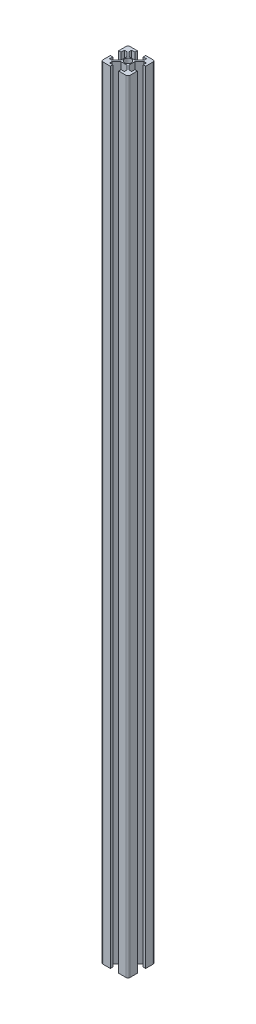
from build123d import *

# Parameters (mm, degrees)
SKETCH_1_R      = 2.5
EXTRUDE_1_DEPTH = 580


with BuildPart() as part:
    # 草图1 → 凸台-拉伸1 (new body)
    with BuildSketch(Plane(origin=(0, 0, 0), x_dir=(1, 0, 0), z_dir=(0, 1, 0))):
        with BuildLine():
            Line((-27.504847279, -8.742955359), (-29.304847279, -8.742955359))
            Line((-29.304847279, -8.742955359), (-29.304847279, -14.142955359))
            ThreePointArc((-29.304847279, -14.142955359), (-28.865507451, -15.20361553), (-27.804847279, -15.642955359))
            Line((-27.804847279, -15.642955359), (-22.404847279, -15.642955359))
            Line((-22.404847279, -15.642955359), (-22.404847279, -13.842955359))
            Line((-22.404847279, -13.842955359), (-24.804847279, -13.842955359))
            Line((-24.804847279, -13.842955359), (-24.804847279, -12.040005514))
            Line((-24.804847279, -12.040005514), (-21.507797124, -8.742955359))
            Line((-21.507797124, -8.742955359), (-17.101897434, -8.742955359))
            Line((-17.101897434, -8.742955359), (-13.804847279, -12.040005514))
            Line((-13.804847279, -12.040005514), (-13.804847279, -13.842955359))
            Line((-13.804847279, -13.842955359), (-16.204847279, -13.842955359))
            Line((-16.204847279, -13.842955359), (-16.204847279, -15.642955359))
            Line((-16.204847279, -15.642955359), (-10.804847279, -15.642955359))
            ThreePointArc((-10.804847279, -15.642955359), (-9.744187108, -15.20361553), (-9.304847279, -14.142955359))
            Line((-9.304847279, -14.142955359), (-9.304847279, -8.742955359))
            Line((-9.304847279, -8.742955359), (-11.104847279, -8.742955359))
            Line((-11.104847279, -8.742955359), (-11.104847279, -11.142955359))
            Line((-11.104847279, -11.142955359), (-12.907797124, -11.142955359))
            Line((-12.907797124, -11.142955359), (-16.250720259, -7.800032224))
            Line((-16.250720259, -7.800032224), (-16.250720259, -3.485878493))
            Line((-16.250720259, -3.485878493), (-12.907797124, -0.142955359))
            Line((-12.907797124, -0.142955359), (-11.104847279, -0.142955359))
            Line((-11.104847279, -0.142955359), (-11.104847279, -2.542955359))
            Line((-11.104847279, -2.542955359), (-9.304847279, -2.542955359))
            Line((-9.304847279, -2.542955359), (-9.304847279, 2.857044641))
            ThreePointArc((-9.304847279, 2.857044641), (-9.744187108, 3.917704813), (-10.804847279, 4.357044641))
            Line((-10.804847279, 4.357044641), (-16.204847279, 4.357044641))
            Line((-16.204847279, 4.357044641), (-16.204847279, 2.557044641))
            Line((-16.204847279, 2.557044641), (-13.804847279, 2.557044641))
            Line((-13.804847279, 2.557044641), (-13.804847279, 0.754094797))
            Line((-13.804847279, 0.754094797), (-17.101897434, -2.542955359))
            Line((-17.101897434, -2.542955359), (-21.507797124, -2.542955359))
            Line((-21.507797124, -2.542955359), (-24.804847279, 0.754094797))
            Line((-24.804847279, 0.754094797), (-24.804847279, 2.557044641))
            Line((-24.804847279, 2.557044641), (-22.404847279, 2.557044641))
            Line((-22.404847279, 2.557044641), (-22.404847279, 4.357044641))
            Line((-22.404847279, 4.357044641), (-27.804847279, 4.357044641))
            ThreePointArc((-27.804847279, 4.357044641), (-28.865507451, 3.917704813), (-29.304847279, 2.857044641))
            Line((-29.304847279, 2.857044641), (-29.304847279, -2.542955359))
            Line((-29.304847279, -2.542955359), (-27.504847279, -2.542955359))
            Line((-27.504847279, -2.542955359), (-27.504847279, -0.142955359))
            Line((-27.504847279, -0.142955359), (-25.701897434, -0.142955359))
            Line((-25.701897434, -0.142955359), (-22.3589743, -3.485878493))
            Line((-22.3589743, -3.485878493), (-22.3589743, -7.800032224))
            Line((-22.3589743, -7.800032224), (-25.701897434, -11.142955359))
            Line((-25.701897434, -11.142955359), (-27.504847279, -11.142955359))
            Line((-27.504847279, -11.142955359), (-27.504847279, -8.742955359))
        make_face()
        with Locations(Location((-19.304847279, -5.642955359, 0), (0, 0, 270))):
            Circle(SKETCH_1_R, mode=Mode.SUBTRACT)
    extrude(amount=EXTRUDE_1_DEPTH)


solid = part.part
